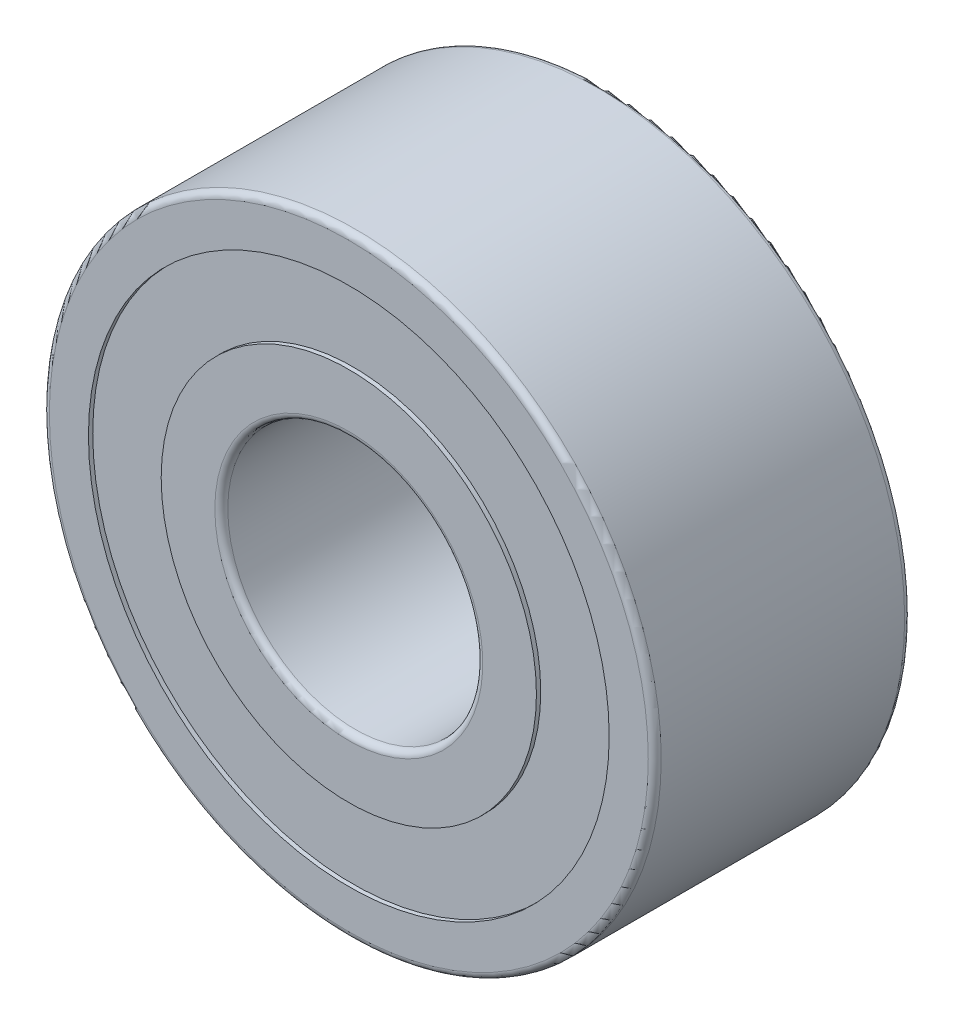
from build123d import *

# Parameters (mm, degrees)
CIRPATTERN1_COUNT = 8
SKETCH5_W         = 0.762
SKETCH5_H         = 8.5598
FILLET1_R         = 0.762
FILLET2_R         = 0.762


with BuildPart() as part:
    # Sketch2 → Revolve1 (revolve)
    with BuildSketch(Plane(origin=(0, 0, 0), x_dir=(0, 0, -1), z_dir=(1, 0, 0)), mode=Mode.PRIVATE) as revolve1_sk:
        with BuildLine():
            Line((15.08125, 15), (15.08125, 22.0726))
            Line((15.08125, 22.0726), (11.48071465, 22.0726))
            ThreePointArc((11.48071465, 22.0726), (7.9375, 20.79625), (4.39428535, 22.0726))
            Line((4.39428535, 22.0726), (-4.39428535, 22.0726))
            ThreePointArc((-4.39428535, 22.0726), (-7.9375, 20.79625), (-11.48071465, 22.0726))
            Line((-11.48071465, 22.0726), (-15.08125, 22.0726))
            Line((-15.08125, 22.0726), (-15.08125, 15))
            Line((-15.08125, 15), (15.08125, 15))
        make_face()
        with BuildLine():
            Line((15.08125, 30.6324), (15.08125, 35.9918))
            Line((15.08125, 35.9918), (-15.08125, 35.9918))
            Line((-15.08125, 35.9918), (-15.08125, 30.6324))
            Line((-15.08125, 30.6324), (-11.48071465, 30.6324))
            ThreePointArc((-11.48071465, 30.6324), (-7.9375, 31.90875), (-4.39428535, 30.6324))
            Line((-4.39428535, 30.6324), (4.39428535, 30.6324))
            ThreePointArc((4.39428535, 30.6324), (7.9375, 31.90875), (11.48071465, 30.6324))
            Line((11.48071465, 30.6324), (15.08125, 30.6324))
        make_face()
    revolve(revolve1_sk.sketch.rotate(Axis((0, 0, 0), (0, 0, -1)), 90), axis=Axis((0, 0, 0), (0, 0, -1)))

    # Fillet1
    fillet1_edges = [part.edges().sort_by_distance(p)[0] for p in [
        (-35.9918, 0, -15.08125),
        (-35.9918, 0, 15.08125),
    ]]
    fillet(fillet1_edges, radius=FILLET1_R)

    # Fillet2
    fillet2_edges = [part.edges().sort_by_distance(p)[0] for p in [
        (-15, 0, 15.08125),
        (-15, 0, -15.08125),
    ]]
    fillet(fillet2_edges, radius=FILLET2_R)


with BuildPart() as body_2:
    # Sketch3 → Revolve2 (revolve)
    with BuildSketch(Plane(origin=(0, 0, 0), x_dir=(0, 0, -1), z_dir=(1, 0, 0))):
        with BuildLine():
            Line((7.9375, 31.90875), (7.9375, 20.79625))
            ThreePointArc((7.9375, 20.79625), (13.49375, 26.3525), (7.9375, 31.90875))
        make_face()
    revolve(axis=Axis((0, 26.3525, -7.9375), (0, 1, 0)))


with BuildPart() as body_3:
    # Sketch4 → Revolve3 (revolve)
    with BuildSketch(Plane(origin=(0, 0, 0), x_dir=(0, 0, -1), z_dir=(1, 0, 0))):
        with BuildLine():
            Line((-7.9375, 31.90875), (-7.9375, 20.79625))
            ThreePointArc((-7.9375, 20.79625), (-13.49375, 26.3525), (-7.9375, 31.90875))
        make_face()
    revolve(axis=Axis((0, 31.90875, 7.9375), (0, -1, 0)))


with BuildPart() as cirpattern1_1:
    # CirPattern1: pattern copy
    add(body_3.part.rotate(Axis((0, 0, 0), (0, 0, 1)), 1 * 360 / CIRPATTERN1_COUNT))


with BuildPart() as cirpattern1_2:
    # CirPattern1: pattern copy
    add(body_3.part.rotate(Axis((0, 0, 0), (0, 0, 1)), 2 * 360 / CIRPATTERN1_COUNT))


with BuildPart() as cirpattern1_3:
    # CirPattern1: pattern copy
    add(body_3.part.rotate(Axis((0, 0, 0), (0, 0, 1)), 3 * 360 / CIRPATTERN1_COUNT))


with BuildPart() as cirpattern1_4:
    # CirPattern1: pattern copy
    add(body_3.part.rotate(Axis((0, 0, 0), (0, 0, 1)), 4 * 360 / CIRPATTERN1_COUNT))


with BuildPart() as cirpattern1_5:
    # CirPattern1: pattern copy
    add(body_3.part.rotate(Axis((0, 0, 0), (0, 0, 1)), 5 * 360 / CIRPATTERN1_COUNT))


with BuildPart() as cirpattern1_6:
    # CirPattern1: pattern copy
    add(body_3.part.rotate(Axis((0, 0, 0), (0, 0, 1)), 6 * 360 / CIRPATTERN1_COUNT))


with BuildPart() as cirpattern1_7:
    # CirPattern1: pattern copy
    add(body_3.part.rotate(Axis((0, 0, 0), (0, 0, 1)), 7 * 360 / CIRPATTERN1_COUNT))


with BuildPart() as cirpattern1_8:
    # CirPattern1: pattern copy
    add(body_2.part.rotate(Axis((0, 0, 0), (0, 0, 1)), 1 * 360 / CIRPATTERN1_COUNT))


with BuildPart() as cirpattern1_9:
    # CirPattern1: pattern copy
    add(body_2.part.rotate(Axis((0, 0, 0), (0, 0, 1)), 2 * 360 / CIRPATTERN1_COUNT))


with BuildPart() as cirpattern1_10:
    # CirPattern1: pattern copy
    add(body_2.part.rotate(Axis((0, 0, 0), (0, 0, 1)), 3 * 360 / CIRPATTERN1_COUNT))


with BuildPart() as cirpattern1_11:
    # CirPattern1: pattern copy
    add(body_2.part.rotate(Axis((0, 0, 0), (0, 0, 1)), 4 * 360 / CIRPATTERN1_COUNT))


with BuildPart() as cirpattern1_12:
    # CirPattern1: pattern copy
    add(body_2.part.rotate(Axis((0, 0, 0), (0, 0, 1)), 5 * 360 / CIRPATTERN1_COUNT))


with BuildPart() as cirpattern1_13:
    # CirPattern1: pattern copy
    add(body_2.part.rotate(Axis((0, 0, 0), (0, 0, 1)), 6 * 360 / CIRPATTERN1_COUNT))


with BuildPart() as cirpattern1_14:
    # CirPattern1: pattern copy
    add(body_2.part.rotate(Axis((0, 0, 0), (0, 0, 1)), 7 * 360 / CIRPATTERN1_COUNT))


with BuildPart() as body_18:
    # Sketch5 → Revolve4 (revolve)
    with BuildSketch(Plane(origin=(0, 0, 0), x_dir=(0, 0, -1), z_dir=(1, 0, 0)), mode=Mode.PRIVATE) as revolve4_sk:
        with Locations((14.19225, 26.3525)):
            Rectangle(SKETCH5_W, SKETCH5_H)
        with Locations((-14.19225, 26.3525)):
            Rectangle(SKETCH5_W, SKETCH5_H)
    revolve(revolve4_sk.sketch.rotate(Axis((0, 0, 0), (0, 0, 1)), 90), axis=Axis((0, 0, 0), (0, 0, 1)))


solid = Compound([part.part, body_2.part, body_3.part, cirpattern1_1.part, cirpattern1_2.part, cirpattern1_3.part, cirpattern1_4.part, cirpattern1_5.part, cirpattern1_6.part, cirpattern1_7.part, cirpattern1_8.part, cirpattern1_9.part, cirpattern1_10.part, cirpattern1_11.part, cirpattern1_12.part, cirpattern1_13.part, cirpattern1_14.part, body_18.part])
